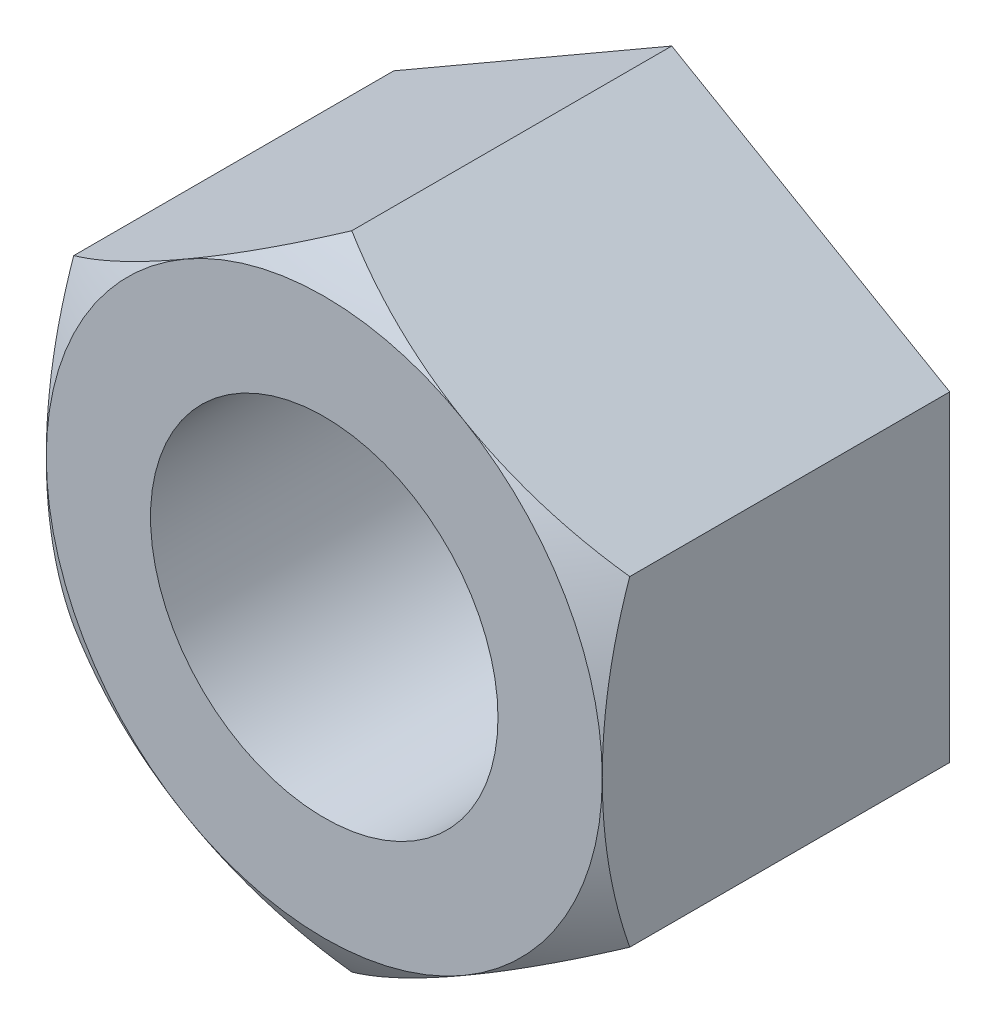
from build123d import *

# Parameters (mm, degrees)
SKETCH_1_R      = 2.5
EXTRUDE_1_DEPTH = 5


with BuildPart() as part:
    # ｽｹｯﾁ1 → ﾎﾞｽ - 押し出し1 (new body)
    with BuildSketch(Plane.XY):
        Polygon((0, 4.618802154), (-4, 2.309401077), (-4, -2.309401077), (0, -4.618802154), (4, -2.309401077), (4, 2.309401077), align=None)
        Circle(SKETCH_1_R, mode=Mode.SUBTRACT)
    extrude(amount=EXTRUDE_1_DEPTH)

    # ｽｹｯﾁ5 → ｶｯﾄ - 回転2 (revolve, cut)
    with BuildSketch(Plane(origin=(0, 0, 0), x_dir=(0, 0, -1), z_dir=(1, 0, 0))):
        with BuildLine():
            Line((-4.603769417, 4.618802154), (-5, 4.618802154))
            Line((-5, 4.618802154), (-5, 4))
            ThreePointArc((-5, 4), (-4.808992974, 4.313952632), (-4.603769417, 4.618802154))
        make_face()
    revolve(axis=Axis((0, 0, 0), (0, 0, 1)), mode=Mode.SUBTRACT)


solid = part.part
